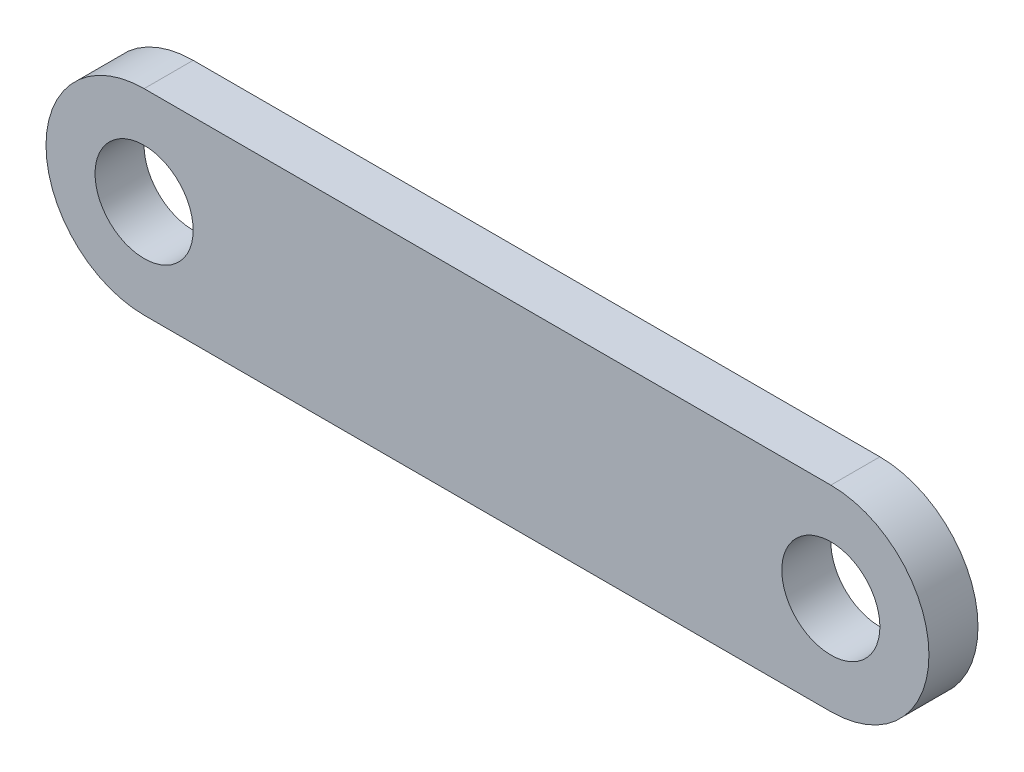
from build123d import *

# Parameters (mm, degrees)
SKETCH1_R           = 5
BOSS_EXTRUDE1_DEPTH = 5


with BuildPart() as part:
    # Sketch1 → Boss-Extrude1 (new body)
    with BuildSketch(Plane.XY):
        with BuildLine():
            Line((-54.933450377, 27.554820012), (15.066549623, 27.554820012))
            ThreePointArc((15.066549623, 27.554820012), (25.066549623, 17.554820012), (15.066549623, 7.554820012))
            Line((15.066549623, 7.554820012), (-54.933450377, 7.554820012))
            ThreePointArc((-54.933450377, 7.554820012), (-64.933450377, 17.554820012), (-54.933450377, 27.554820012))
        make_face()
        with Locations((-54.933450377, 17.554820012)):
            Circle(SKETCH1_R, mode=Mode.SUBTRACT)
        with Locations((15.066549623, 17.554820012)):
            Circle(SKETCH1_R, mode=Mode.SUBTRACT)
    extrude(amount=BOSS_EXTRUDE1_DEPTH)


solid = part.part
